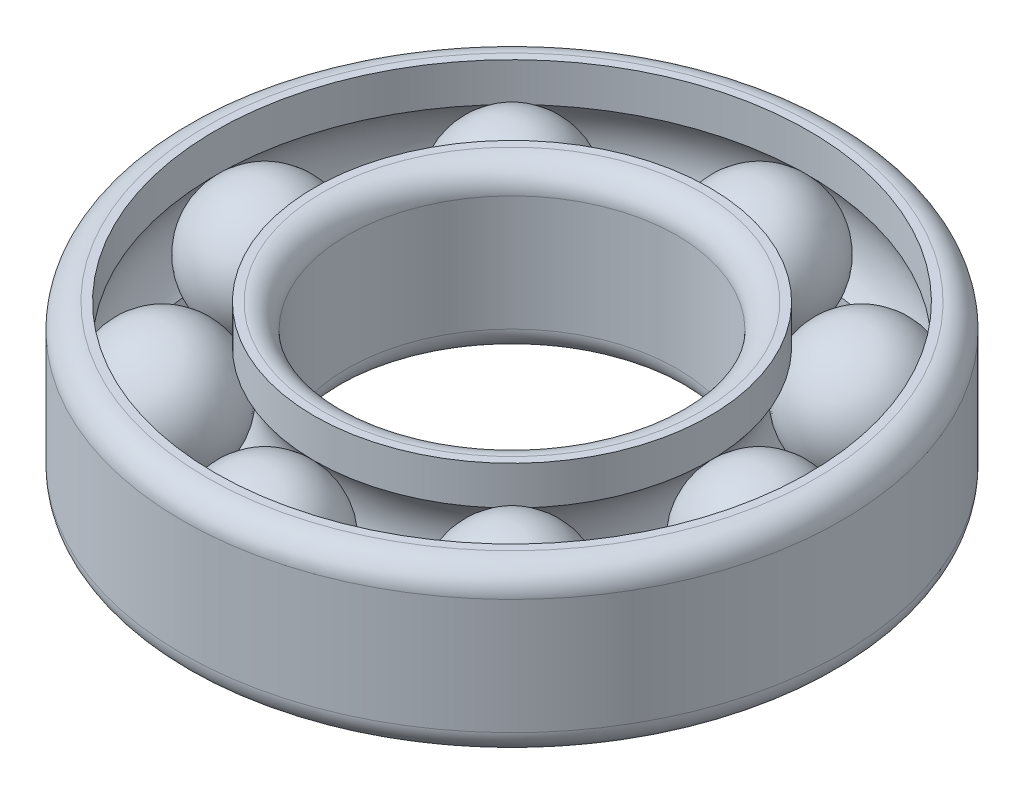
from build123d import *

# Parameters (mm, degrees)
FILLET1_R         = 0.15
FILLET2_R         = 0.15
CIRPATTERN3_COUNT = 8


with BuildPart() as part:
    # Sketch1 → Revolve1 (revolve)
    with BuildSketch(Plane.XY):
        with BuildLine():
            ThreePointArc((-1.2, -0.264575131), (-1.1, 0), (-1.2, 0.264575131))
            ThreePointArc((-1.2, 0.264575131), (-1.335424869, 0.364575131), (-1.5, 0.4))
            Line((-1.5, 0.4), (-1.5, -0.4))
            ThreePointArc((-1.5, -0.4), (-1.335424869, -0.364575131), (-1.2, -0.264575131))
        make_face()
    revolve(axis=Axis((-1.5, 0.4, 0), (0, -1, 0)))


with BuildPart() as body_2:
    # Sketch1<3> → Revolve2 (revolve)
    with BuildSketch(Plane.XY):
        with BuildLine():
            Line((-1, 0.5), (-1.2, 0.5))
            Line((-1.2, 0.5), (-1.2, 0.264575131))
            ThreePointArc((-1.2, 0.264575131), (-1.1, 0), (-1.2, -0.264575131))
            Line((-1.2, -0.264575131), (-1.2, -0.5))
            Line((-1.2, -0.5), (-1, -0.5))
            Line((-1, -0.5), (-1, 0.5))
        make_face()
        with BuildLine():
            Line((-1.8, 0.5), (-2, 0.5))
            Line((-2, 0.5), (-2, -0.5))
            Line((-2, -0.5), (-1.8, -0.5))
            Line((-1.8, -0.5), (-1.8, -0.264575131))
            ThreePointArc((-1.8, -0.264575131), (-1.9, 0), (-1.8, 0.264575131))
            Line((-1.8, 0.264575131), (-1.8, 0.5))
        make_face()
    revolve(axis=Axis((0, 0.55, 0), (0, -1, 0)))

    # Fillet1
    fillet1_edges = [body_2.edges().sort_by_distance(p)[0] for p in [
        (2, 0.5, 0),
        (2, -0.5, 0),
    ]]
    fillet(fillet1_edges, radius=FILLET1_R)

    # Fillet2
    fillet2_edges = [body_2.edges().sort_by_distance(p)[0] for p in [
        (1, 0.5, 0),
        (1, -0.5, 0),
    ]]
    fillet(fillet2_edges, radius=FILLET2_R)


with BuildPart() as cirpattern3_1:
    # CirPattern3: pattern copy
    add(part.part.rotate(Axis((0, 0.55, 0), (0, -1, 0)), 1 * 360 / CIRPATTERN3_COUNT))


with BuildPart() as cirpattern3_2:
    # CirPattern3: pattern copy
    add(part.part.rotate(Axis((0, 0.55, 0), (0, -1, 0)), 2 * 360 / CIRPATTERN3_COUNT))


with BuildPart() as cirpattern3_3:
    # CirPattern3: pattern copy
    add(part.part.rotate(Axis((0, 0.55, 0), (0, -1, 0)), 3 * 360 / CIRPATTERN3_COUNT))


with BuildPart() as cirpattern3_4:
    # CirPattern3: pattern copy
    add(part.part.rotate(Axis((0, 0.55, 0), (0, -1, 0)), 4 * 360 / CIRPATTERN3_COUNT))


with BuildPart() as cirpattern3_5:
    # CirPattern3: pattern copy
    add(part.part.rotate(Axis((0, 0.55, 0), (0, -1, 0)), 5 * 360 / CIRPATTERN3_COUNT))


with BuildPart() as cirpattern3_6:
    # CirPattern3: pattern copy
    add(part.part.rotate(Axis((0, 0.55, 0), (0, -1, 0)), 6 * 360 / CIRPATTERN3_COUNT))


with BuildPart() as cirpattern3_7:
    # CirPattern3: pattern copy
    add(part.part.rotate(Axis((0, 0.55, 0), (0, -1, 0)), 7 * 360 / CIRPATTERN3_COUNT))


solid = Compound([part.part, body_2.part, cirpattern3_1.part, cirpattern3_2.part, cirpattern3_3.part, cirpattern3_4.part, cirpattern3_5.part, cirpattern3_6.part, cirpattern3_7.part])
